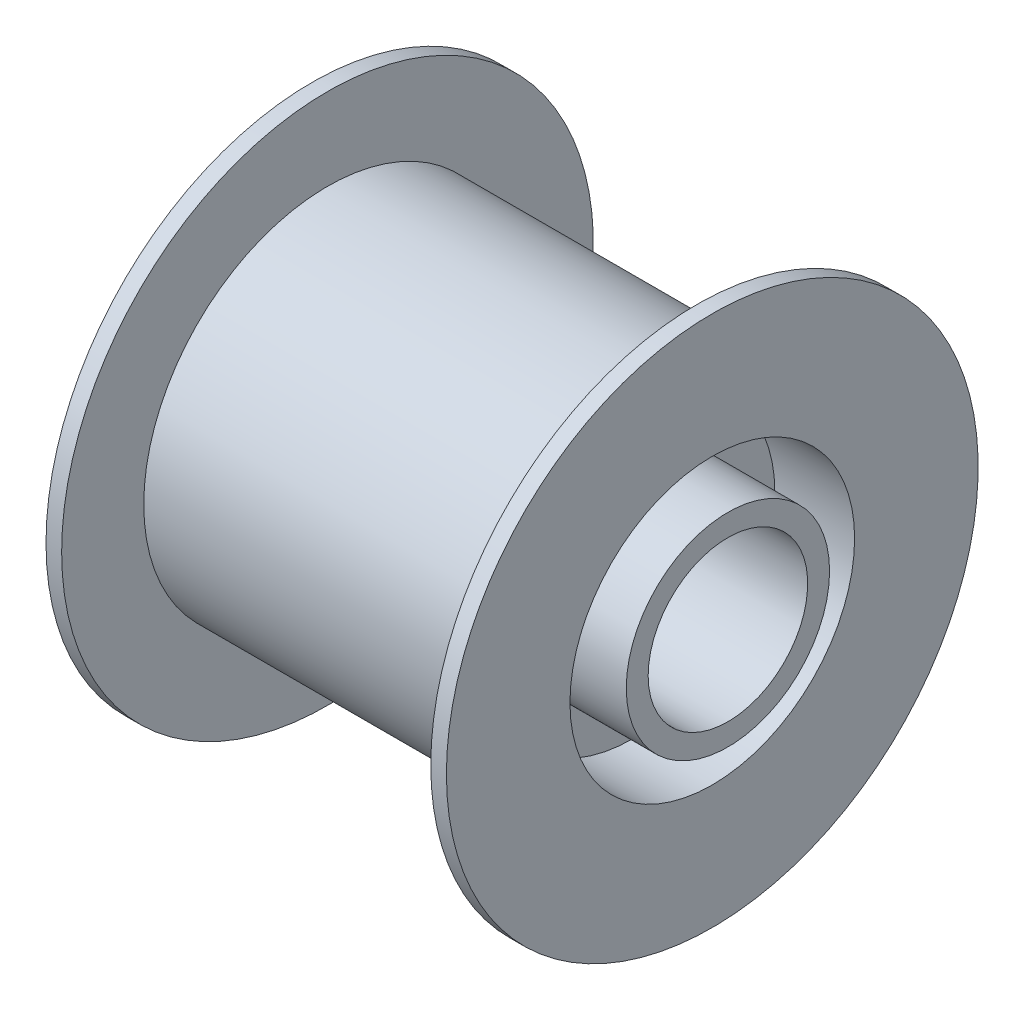
from build123d import *


with BuildPart() as part:
    # Sketch1 → Revolve1 (revolve)
    with BuildSketch(Plane.XY, mode=Mode.PRIVATE) as revolve1_sk:
        Polygon((0, 6.5), (0, 5.1), (27.6, 5.1), (27.6, 6.5), (21.5, 6.5), (21.5, 9.1), (26.6, 9.1), (26.6, 17), (25.6, 17), (25.6, 11.75), (2, 11.75), (2, 17), (1, 17), (1, 9.1), (6.1, 9.1), (6.1, 6.5), align=None)
    revolve(revolve1_sk.sketch.rotate(Axis((0, 0, 0), (1, 0, 0)), 90), axis=Axis((0, 0, 0), (1, 0, 0)))


solid = part.part
